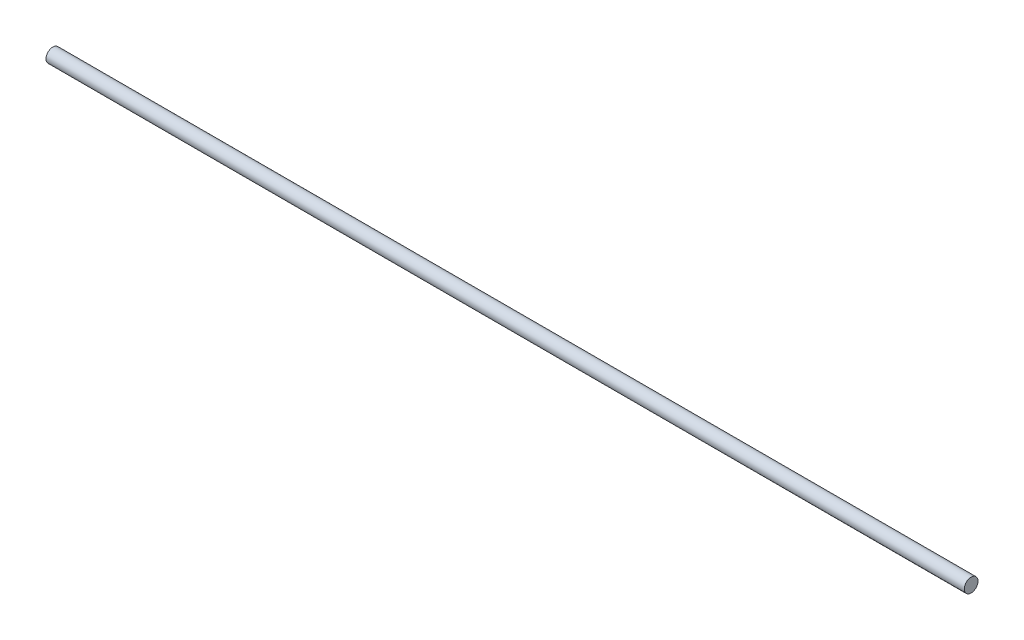
from build123d import *


with BuildPart() as part:
    # Sketch2 → Revolve1 (revolve)
    with BuildSketch(Plane.XY, mode=Mode.PRIVATE) as revolve1_sk:
        Polygon((0, 0), (0, 1.5), (-200, 1.5), (-200, 0.75), (-190, 0.75), (-190, 0), align=None)
    revolve(revolve1_sk.sketch.rotate(Axis((-190, 0, 0), (1, 0, 0)), 90), axis=Axis((-190, 0, 0), (1, 0, 0)))


solid = part.part
